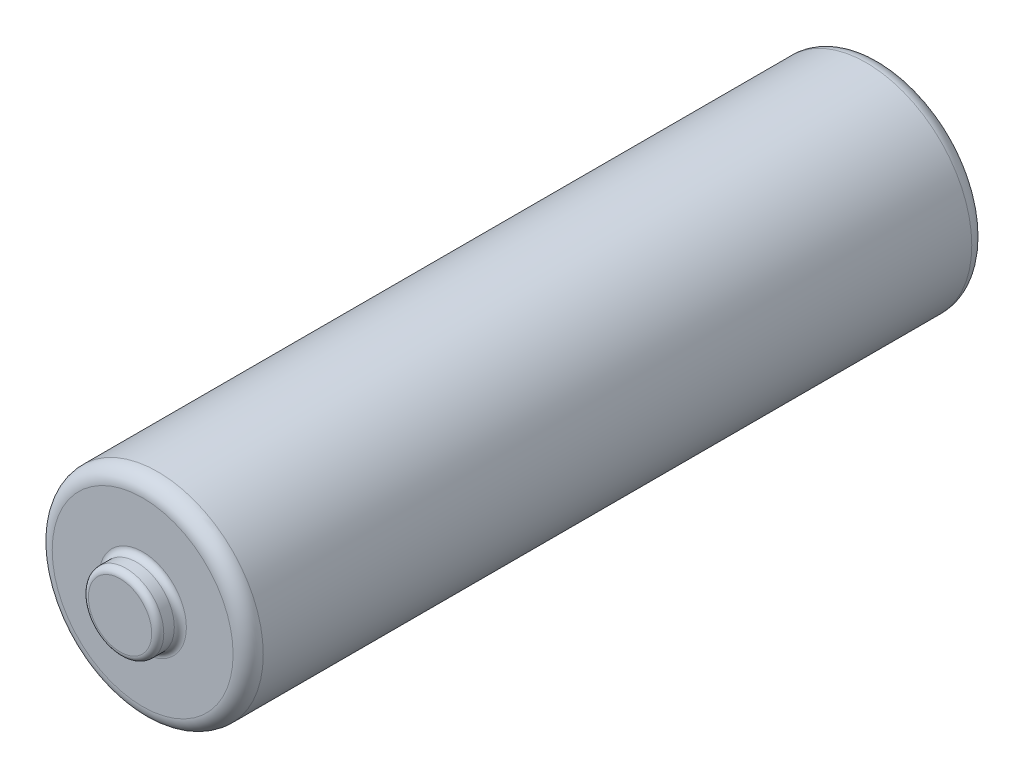
from build123d import *

# Parameters (mm, degrees)
SKETCH1_R           = 7
BOSS_EXTRUDE1_DEPTH = 49
SKETCH2_R           = 2.5
BOSS_EXTRUDE2_DEPTH = 1.5
FILLET1_R           = 1
FILLET2_R           = 0.4


with BuildPart() as part:
    # Sketch1 → Boss-Extrude1 (new body)
    with BuildSketch(Plane.XY):
        Circle(SKETCH1_R)
    extrude(amount=BOSS_EXTRUDE1_DEPTH)

    # Sketch2 → Boss-Extrude2 (add)
    with BuildSketch(Plane.XY.offset(49)):
        Circle(SKETCH2_R)
    extrude(amount=BOSS_EXTRUDE2_DEPTH)

    # Fillet1
    fillet1_edges = [part.edges().sort_by_distance(p)[0] for p in [
        (-7, 0, 0),
        (-7, 0, 49),
    ]]
    fillet(fillet1_edges, radius=FILLET1_R)

    # Fillet2
    fillet2_edges = [part.edges().sort_by_distance(p)[0] for p in [
        (-2.5, 0, 49),
        (-2.5, 0, 50.5),
    ]]
    fillet(fillet2_edges, radius=FILLET2_R)


solid = part.part
